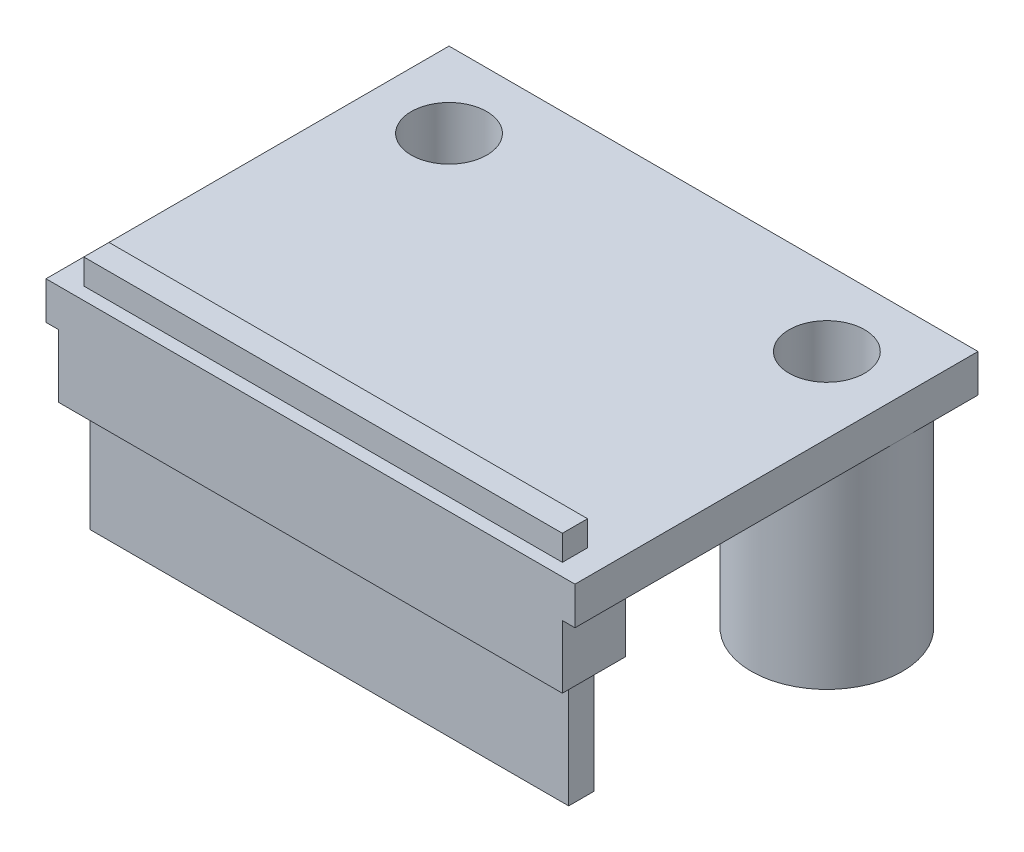
from build123d import *

# Parameters (mm, degrees)
SKETCH_1_W      = 21
SKETCH_1_H      = 16
SKETCH_1_R      = 1.5
EXTRUDE_2_DEPTH = 1.5
SKETCH_1_4_W    = 19
SKETCH_1_4_H    = 1
EXTRUDE_3_DEPTH = 1
SKETCH_3_W      = 19
SKETCH_3_H      = 1
EXTRUDE_4_DEPTH = 7
SKETCH_3_3_W    = 20
SKETCH_3_3_H    = 2.5
EXTRUDE_5_DEPTH = 2.5
SKETCH_4_R      = 3
SKETCH_4_R_2    = 1.5
EXTRUDE_6_DEPTH = 8


with BuildPart() as part:
    # Эскиз1 → Бобышка-Вытянуть2 (new body)
    with BuildSketch(Plane(origin=(0, 0, 0), x_dir=(1, 0, 0), z_dir=(0, 1, 0))):
        Rectangle(SKETCH_1_W, SKETCH_1_H)
        with Locations((-7.5, 5)):
            Circle(SKETCH_1_R, mode=Mode.SUBTRACT)
        with Locations((7.5, 5)):
            Circle(SKETCH_1_R, mode=Mode.SUBTRACT)
    extrude(amount=-EXTRUDE_2_DEPTH)

    # Эскиз1<4> → Бобышка-Вытянуть3 (add)
    with BuildSketch(Plane(origin=(0, 0, 0), x_dir=(1, 0, 0), z_dir=(0, 1, 0))):
        with Locations((0, -7)):
            Rectangle(SKETCH_1_4_W, SKETCH_1_4_H)
    extrude(amount=EXTRUDE_3_DEPTH)

    # Эскиз3 → Бобышка-Вытянуть4 (add)
    with BuildSketch(Plane.XZ.offset(1.5)):
        with Locations((0, 6.75)):
            Rectangle(SKETCH_3_W, SKETCH_3_H)
    extrude(amount=EXTRUDE_4_DEPTH)

    # Эскиз3<3> → Бобышка-Вытянуть5 (add)
    with BuildSketch(Plane.XZ.offset(1.5)):
        with Locations((0, 6.75)):
            Rectangle(SKETCH_3_3_W, SKETCH_3_3_H)
    extrude(amount=EXTRUDE_5_DEPTH)

    # Эскиз4 → Бобышка-Вытянуть6 (add)
    # profile 1 of 2: a face of its own
    with BuildSketch(Plane.XZ.offset(1.5)):
        with Locations((-7.5, -5)):
            Circle(SKETCH_4_R)
        with Locations((-7.5, -5)):
            Circle(SKETCH_4_R_2, mode=Mode.SUBTRACT)
    # profile 2 of 2: a face of its own
    with BuildSketch(Plane.XZ.offset(1.5)):
        with Locations((7.5, -5)):
            Circle(SKETCH_4_R)
        with Locations((7.5, -5)):
            Circle(SKETCH_4_R_2, mode=Mode.SUBTRACT)
    extrude(amount=EXTRUDE_6_DEPTH)


solid = part.part
